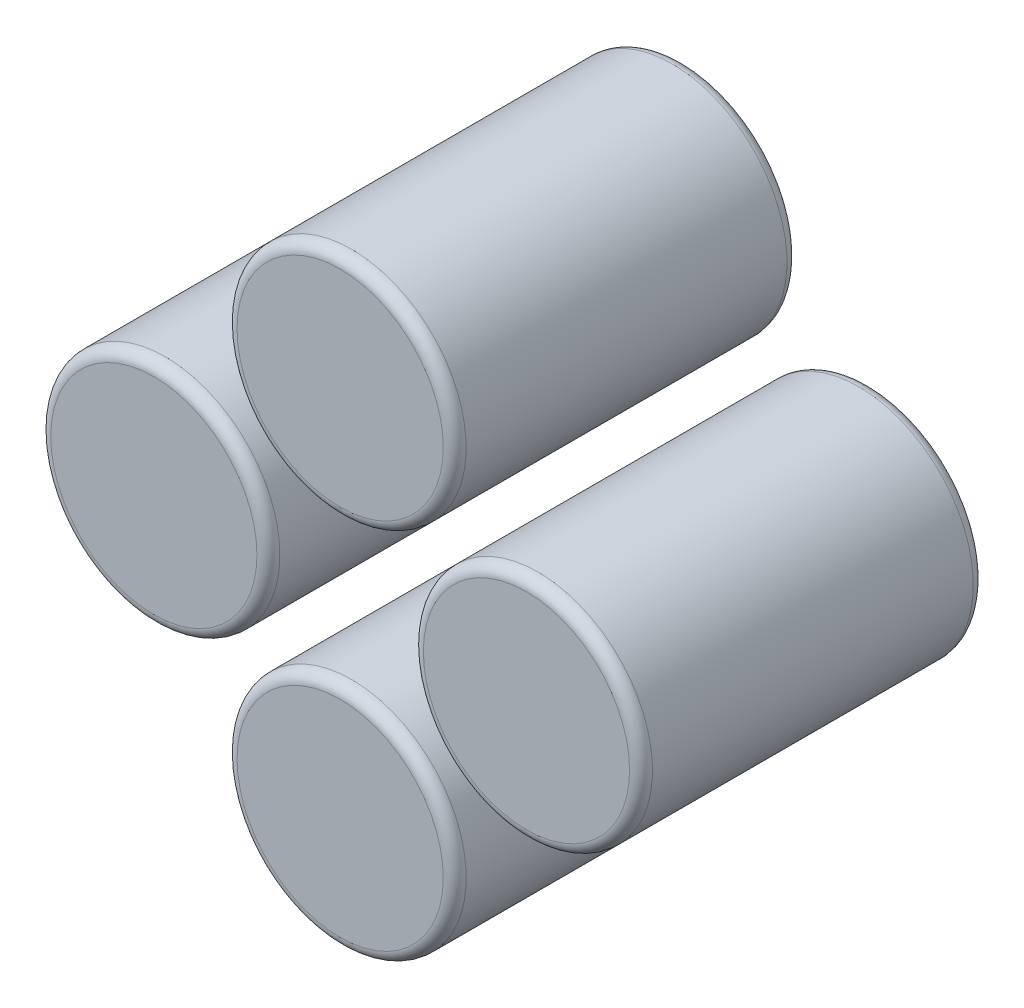
from build123d import *

# Parameters (mm, degrees)
SKETCH_1_R        = 5
EXTRUDE_1_DEPTH   = 7.5
EXTRUDE_1_2_DEPTH = 7.5
EXTRUDE_1_3_DEPTH = 7.5
EXTRUDE_1_4_DEPTH = 7.5
FILLET_1_R        = 0.5
FILLET_2_R        = 0.5
FILLET_3_R        = 0.5
FILLET_4_R        = 0.5


with BuildPart() as part:
    # 草图1 → 凸台-拉伸1 (new, symmetric)
    with BuildSketch(Plane(origin=(-51, 0, 0), x_dir=(-1, 0, 0), z_dir=(0, 0, -1))):
        with Locations((-42.868272016, 0)):
            Circle(SKETCH_1_R)
    extrude(amount=EXTRUDE_1_DEPTH, both=True)

    # 圆角4
    fillet_4_edges = [part.edges().sort_by_distance(p)[0] for p in [
        (-3.131727984, 0, 7.5),
        (-3.131727984, 0, -7.5),
    ]]
    fillet(fillet_4_edges, radius=FILLET_4_R)


with BuildPart() as body_2:
    # 草图1 → Extrude 1 2 (new, symmetric)
    with BuildSketch(Plane(origin=(-51, 0, 0), x_dir=(-1, 0, 0), z_dir=(0, 0, -1))):
        with Locations((-51, -8.131727984)):
            Circle(SKETCH_1_R)
    extrude(amount=EXTRUDE_1_2_DEPTH, both=True)

    # 圆角2
    fillet_2_edges = [body_2.edges().sort_by_distance(p)[0] for p in [
        (5, -8.131727984, 7.5),
        (5, -8.131727984, -7.5),
    ]]
    fillet(fillet_2_edges, radius=FILLET_2_R)


with BuildPart() as body_3:
    # 草图1 → Extrude 1 3 (new, symmetric)
    with BuildSketch(Plane(origin=(-51, 0, 0), x_dir=(-1, 0, 0), z_dir=(0, 0, -1))):
        with Locations((-51, 8.131727984)):
            Circle(SKETCH_1_R)
    extrude(amount=EXTRUDE_1_3_DEPTH, both=True)

    # 圆角3
    fillet_3_edges = [body_3.edges().sort_by_distance(p)[0] for p in [
        (5, 8.131727984, 7.5),
        (5, 8.131727984, -7.5),
    ]]
    fillet(fillet_3_edges, radius=FILLET_3_R)


with BuildPart() as body_4:
    # 草图1 → Extrude 1 4 (new, symmetric)
    with BuildSketch(Plane(origin=(-51, 0, 0), x_dir=(-1, 0, 0), z_dir=(0, 0, -1))):
        with Locations((-59.131727984, 0)):
            Circle(SKETCH_1_R)
    extrude(amount=EXTRUDE_1_4_DEPTH, both=True)

    # 圆角1
    fillet_1_edges = [body_4.edges().sort_by_distance(p)[0] for p in [
        (13.131727984, 0, 7.5),
        (13.131727984, 0, -7.5),
    ]]
    fillet(fillet_1_edges, radius=FILLET_1_R)


solid = Compound([part.part, body_2.part, body_3.part, body_4.part])
